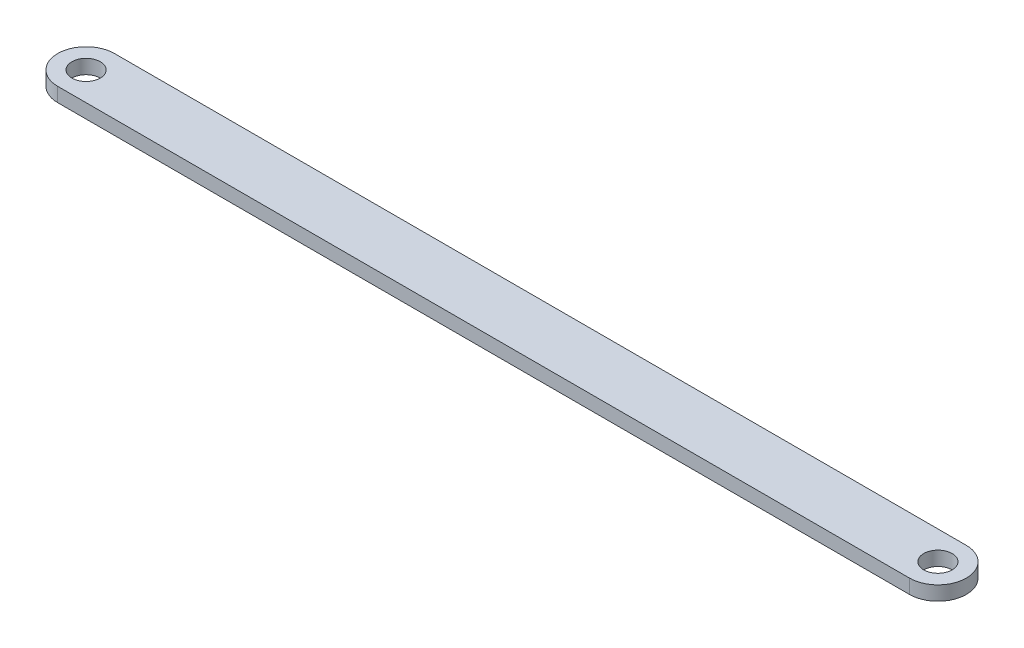
from build123d import *

# Parameters (mm, degrees)
SKETCH1_R           = 5
BOSS_EXTRUDE1_DEPTH = 5


with BuildPart() as part:
    # Sketch1 → Boss-Extrude1 (new body)
    with BuildSketch(Plane(origin=(0, 0, 0), x_dir=(1, 0, 0), z_dir=(0, 1, 0))):
        with BuildLine():
            Line((-150, 10), (150, 10))
            ThreePointArc((150, 10), (160, 0), (150, -10))
            Line((150, -10), (-150, -10))
            ThreePointArc((-150, -10), (-160, 0), (-150, 10))
        make_face()
        with Locations(Location((-150, 0, 0), (0, 0, 270))):
            Circle(SKETCH1_R, mode=Mode.SUBTRACT)
        with Locations(Location((150, 0, 0), (0, 0, 270))):
            Circle(SKETCH1_R, mode=Mode.SUBTRACT)
    extrude(amount=BOSS_EXTRUDE1_DEPTH)


solid = part.part
